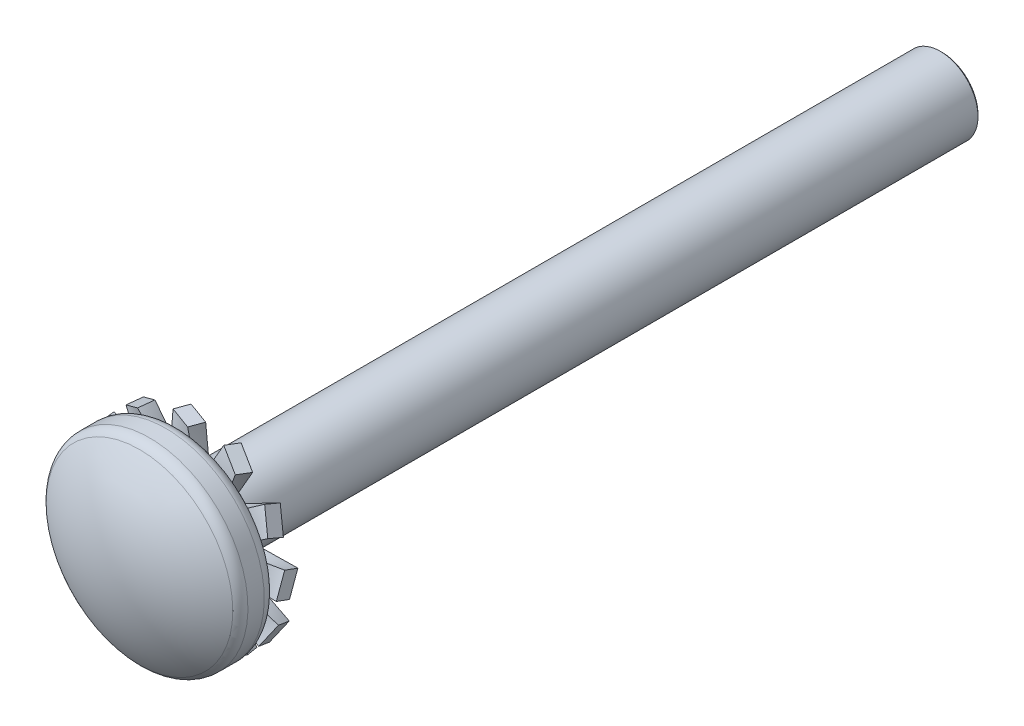
from build123d import *

# Parameters (mm, degrees)
SKETCH3_W           = 31.75
SKETCH3_H           = 1.567244252
SKETCH38_OUTSIDE_W  = 77.2
SKETCH38_OUTSIDE_H  = 77.2
SKETCH38_OUTSIDE_R  = 1.4874875
EXTRUDE6_DEPTH      = 32.827268326
EXTRUDE6_DRAFT      = -45
SKETCH8_W           = 2.921
SKETCH8_H           = 4.0894
SKETCH21_R          = 2.690784338
SKETCH21_R_2        = 1.567244252
EXTRUDE2_DEPTH      = 0.5842
EXTRUDE3_REACH      = 37.564
EXTRUDE3_END_RADIUS = 2.690784338
SKETCH33_W          = 1.016
SKETCH33_H          = 0.5842
CIRPATTERN4_COUNT   = 12


with BuildPart() as part:
    # Sketch3 → Revolve1 (revolve)
    with BuildSketch(Plane(origin=(0, 0, 0), x_dir=(0, 0, -1), z_dir=(1, 0, 0))):
        with Locations((-15.875, 0.783622126)):
            Rectangle(SKETCH3_W, SKETCH3_H)
    revolve(axis=Axis((0, 0, 0), (0, 0, 1)))


with BuildPart() as extrude6_tool:
    # Sketch38 outside → Extrude6 (with draft: the straight prism first)
    with BuildSketch(Plane(origin=(0, 0, 0), x_dir=(-1, 0, 0), z_dir=(0, 0, -1))):
        Rectangle(SKETCH38_OUTSIDE_W, SKETCH38_OUTSIDE_H)
        Circle(SKETCH38_OUTSIDE_R, mode=Mode.SUBTRACT)
    extrude(amount=-EXTRUDE6_DEPTH)
    # Extrude6: the draft: its side faces are tilted about the plane it starts from
    extrude6_sides = [extrude6_tool.faces().sort_by_distance(p)[0] for p in [
        (0, -38.6, 16.413634163),
        (-38.6, 0, 16.413634163),
        (0, 38.6, 16.413634163),
        (38.6, 0, 16.413634163),
        (1.4874875, 0, 16.413634163),
    ]]
    draft(extrude6_sides, Plane(origin=(0, 0, 0), x_dir=(-1, 0, 0), z_dir=(0, 0, -1)), EXTRUDE6_DRAFT)


with BuildPart() as part_1:
    add(part.part)

    # Extrude6: cut by extrude6_tool
    add(extrude6_tool.part, mode=Mode.SUBTRACT)

    # Sketch8 → Revolve2 (revolve)
    with BuildSketch(Plane(origin=(0, 0, 0), x_dir=(0, 0, -1), z_dir=(1, 0, 0)), mode=Mode.PRIVATE) as revolve2_sk:
        with Locations((-33.2105, 2.0447)):
            Rectangle(SKETCH8_W, SKETCH8_H)
    revolve(revolve2_sk.sketch.rotate(Axis((0, 0, 0), (0, 0, 1)), 90), axis=Axis((0, 0, 0), (0, 0, 1)))

    # Sketch11 → Cut-Revolve3 (revolve, cut)
    with BuildSketch(Plane(origin=(0, 0, 0), x_dir=(0, 0, -1), z_dir=(1, 0, 0)), mode=Mode.PRIVATE) as cut_revolve3_sk:
        with BuildLine():
            Line((-32.954906874, 4.0894), (-32.27578, 4.0894))
            ThreePointArc((-32.27578, 4.0894), (-31.903997397, 3.935402603), (-31.75, 3.56362))
            Line((-31.75, 3.56362), (-31.115, 3.56362))
            Line((-31.115, 3.56362), (-31.115, 4.7244))
            Line((-31.115, 4.7244), (-35.306, 4.7244))
            Line((-35.306, 4.7244), (-35.306, 0))
            Line((-35.306, 0), (-34.671, 0))
            ThreePointArc((-34.671, 0), (-34.338470898, 2.045152261), (-33.375141868, 3.87960601))
            ThreePointArc((-33.375141868, 3.87960601), (-33.189753083, 4.034036694), (-32.954906874, 4.0894))
        make_face()
    revolve(cut_revolve3_sk.sketch.rotate(Axis((0, 0, 34.671), (0, 0, -1)), 180), axis=Axis((0, 0, 34.671), (0, 0, -1)), mode=Mode.SUBTRACT)


with BuildPart() as body_2:
    # Sketch21 → Extrude2 (new body)
    with BuildSketch(Plane.XY.offset(31.593869553)):
        Circle(SKETCH21_R)
        Circle(SKETCH21_R_2, mode=Mode.SUBTRACT)
    extrude(amount=-EXTRUDE2_DEPTH)

    # Extrude3: up to this cylinder (the profile starts outside it)
    extrude3_end = Plane(origin=(0, 0, 31.30177), z_dir=(0, 0, 1)) * Cylinder(EXTRUDE3_END_RADIUS, 81.509568677, mode=Mode.PRIVATE)
    # Sketch33 → Extrude3 (add, up to the surface)
    with BuildSketch(Plane(origin=(0, 2.690784338, 0), x_dir=(-1, 0, 0), z_dir=(0, 1, 0)), mode=Mode.PRIVATE) as extrude3_sk1:
        with Locations((0, 31.301769553)):
            Rectangle(SKETCH33_W, SKETCH33_H)
    extrude3_tool1 = extrude(extrude3_sk1.sketch, amount=-EXTRUDE3_REACH, mode=Mode.PRIVATE) - extrude3_end
    extrude3 = extrude3_tool1.solids().sort_by_distance((0, 2.690784, 31.30177))[0] + extrude3_tool1.solids().sort_by_distance((0, 2.690784, 31.30177))[1]
    add(extrude3)

    # Sketch32 → Loft2 section 0
    with BuildSketch(Plane(origin=(0, 4.064, 0), x_dir=(-1, 0, 0), z_dir=(0, 1, 0))):
        with BuildLine():
            Line((-0.377459767, 31.75), (-0.577267935, 31.201031571))
            Line((-0.577267935, 31.201031571), (0.377459767, 30.853539105))
            Line((0.377459767, 30.853539105), (0.577267935, 31.402507534))
            Line((0.577267935, 31.402507534), (-0.377459767, 31.75))
        make_face()
    # Sketch31 → Loft2 section 1
    with BuildSketch(Plane(origin=(0, 2.690784338, 0), x_dir=(-1, 0, 0), z_dir=(0, 1, 0))):
        with BuildLine():
            Line((-0.508, 31.593869553), (0.508, 31.593869553))
            Line((0.508, 31.593869553), (0.508, 31.009669553))
            Line((0.508, 31.009669553), (-0.508, 31.009669553))
            Line((-0.508, 31.009669553), (-0.508, 31.593869553))
        make_face()
    loft2 = loft()

    # CirPattern4: Extrude3, Loft2 ×12 about axis
    cirpattern4_axis = Axis((0, 0, 31.009669553), (0, 0, 1))
    add([extrude3.rotate(cirpattern4_axis, i * 360 / CIRPATTERN4_COUNT) for i in range(1, CIRPATTERN4_COUNT)])
    add([loft2.rotate(cirpattern4_axis, i * 360 / CIRPATTERN4_COUNT) for i in range(1, CIRPATTERN4_COUNT)])


solid = Compound([part_1.part, body_2.part])
